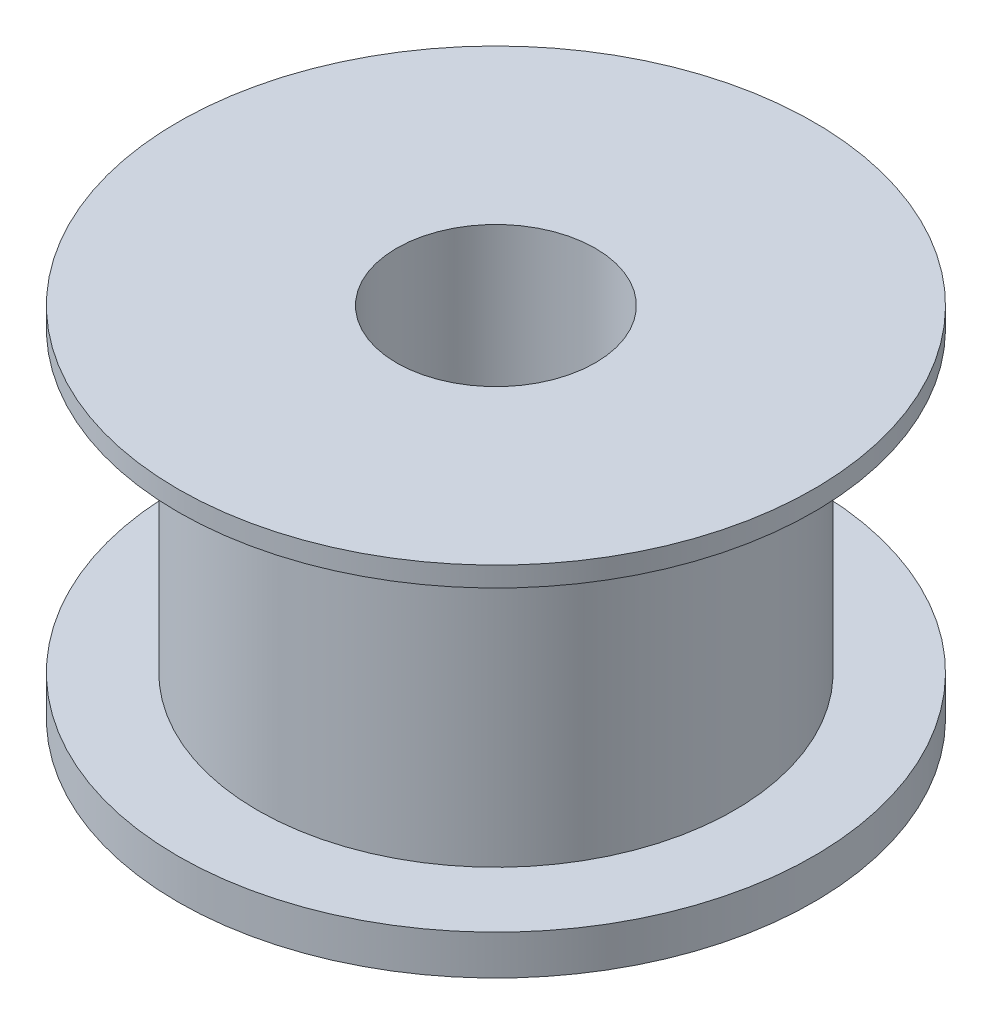
from build123d import *

# Parameters (mm, degrees)
SKETCH_1_R          = 8
EXTRUDE_1_DEPTH     = 1
SKETCH_2_R          = 6
EXTRUDE_2_DEPTH     = 7.5
SKETCH_3_R          = 8
EXTRUDE_3_DEPTH     = 0.5
CUT_EXTRUDE_1_REACH = 16.457
SKETCH_4_R          = 2.5


with BuildPart() as part:
    # 草图1 → 凸台-拉伸1 (new body)
    with BuildSketch(Plane(origin=(0, 0, 0), x_dir=(1, 0, 0), z_dir=(0, 1, 0))):
        with Locations(Location((0, 0, 0), (0, 0, 270))):
            Circle(SKETCH_1_R)
    extrude(amount=EXTRUDE_1_DEPTH)

    # 草图2 → 凸台-拉伸2 (add)
    with BuildSketch(Plane(origin=(0, 1, 0), x_dir=(1, 0, 0), z_dir=(0, 1, 0))):
        with Locations(Location((0, 0, 0), (0, 0, 270))):
            Circle(SKETCH_2_R)
    extrude(amount=EXTRUDE_2_DEPTH)

    # 草图3 → 凸台-拉伸3 (add)
    with BuildSketch(Plane(origin=(0, 8.5, 0), x_dir=(1, 0, 0), z_dir=(0, 1, 0))):
        with Locations(Location((0, 0, 0), (0, 0, 270))):
            Circle(SKETCH_3_R)
    extrude(amount=EXTRUDE_3_DEPTH)

    # 草图4 → 切除-拉伸1 (cut, up to next)
    with BuildSketch(Plane.XZ, mode=Mode.PRIVATE) as cut_extrude_1_sk1:
        with Locations(Location((0, 0, 0), (0, 0, 270))):
            Circle(SKETCH_4_R)
    cut_extrude_1_tool1 = extrude(cut_extrude_1_sk1.sketch, amount=-CUT_EXTRUDE_1_REACH, mode=Mode.PRIVATE) & part.part
    add(cut_extrude_1_tool1.solids().sort_by_distance((0, 0, 0))[0], mode=Mode.SUBTRACT)


solid = part.part
